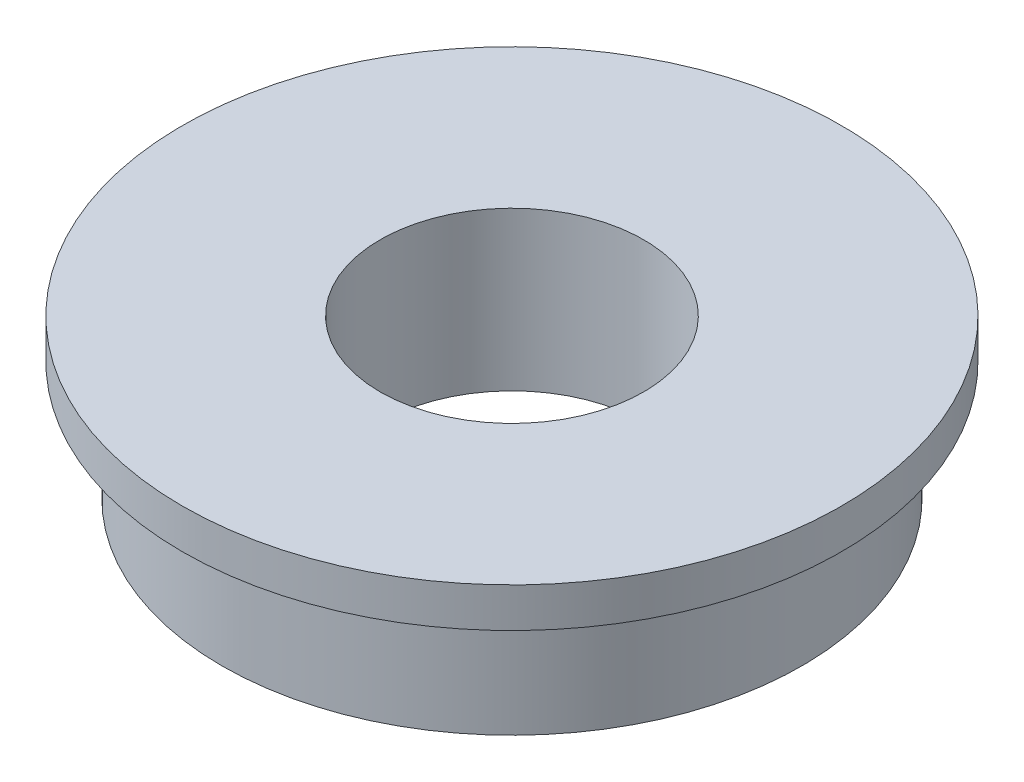
from build123d import *

# Parameters (mm, degrees)
SKETCH1_R           = 11
SKETCH1_R_2         = 5
BOSS_EXTRUDE1_DEPTH = 4.5
SKETCH2_R           = 12.5
SKETCH2_R_2         = 5
BOSS_EXTRUDE2_DEPTH = 1.5


with BuildPart() as part:
    # Sketch1 → Boss-Extrude1 (new body)
    with BuildSketch(Plane(origin=(0, 0, 0), x_dir=(1, 0, 0), z_dir=(0, 1, 0))):
        with Locations(Location((0, 0, 0), (0, 0, 270))):
            Circle(SKETCH1_R)
        with Locations(Location((0, 0, 0), (0, 0, 270))):
            Circle(SKETCH1_R_2, mode=Mode.SUBTRACT)
    extrude(amount=BOSS_EXTRUDE1_DEPTH)

    # Sketch2 → Boss-Extrude2 (add)
    with BuildSketch(Plane(origin=(0, 4.5, 0), x_dir=(1, 0, 0), z_dir=(0, 1, 0))):
        with Locations(Location((0, 0, 0), (0, 0, 270))):
            Circle(SKETCH2_R)
        with Locations(Location((0, 0, 0), (0, 0, 270))):
            Circle(SKETCH2_R_2, mode=Mode.SUBTRACT)
    extrude(amount=BOSS_EXTRUDE2_DEPTH)


solid = part.part
